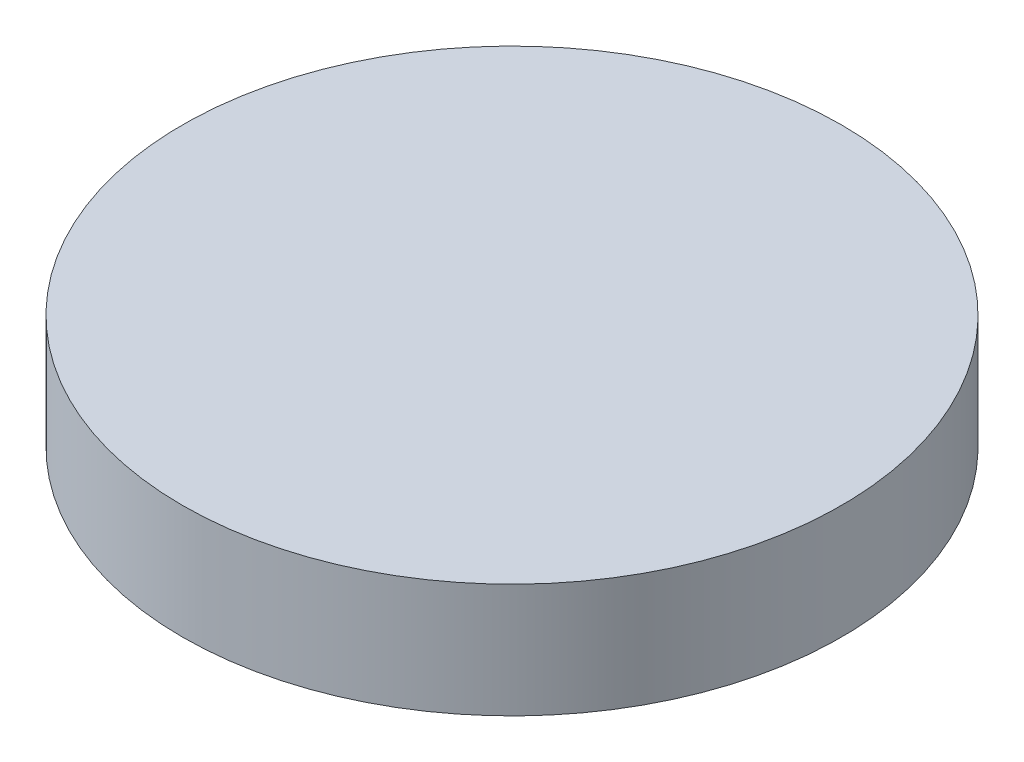
from build123d import *

# Parameters (mm, degrees)
SKETCH1_W = 650
SKETCH1_H = 225


with BuildPart() as part:
    # Sketch1 → Revolve1 (revolve)
    with BuildSketch(Plane.XY, mode=Mode.PRIVATE) as revolve1_sk:
        with Locations((325, 12.5)):
            Rectangle(SKETCH1_W, SKETCH1_H)
    revolve(revolve1_sk.sketch.rotate(Axis((0, -100, 0), (0, 1, 0)), 90), axis=Axis((0, -100, 0), (0, 1, 0)))


solid = part.part
